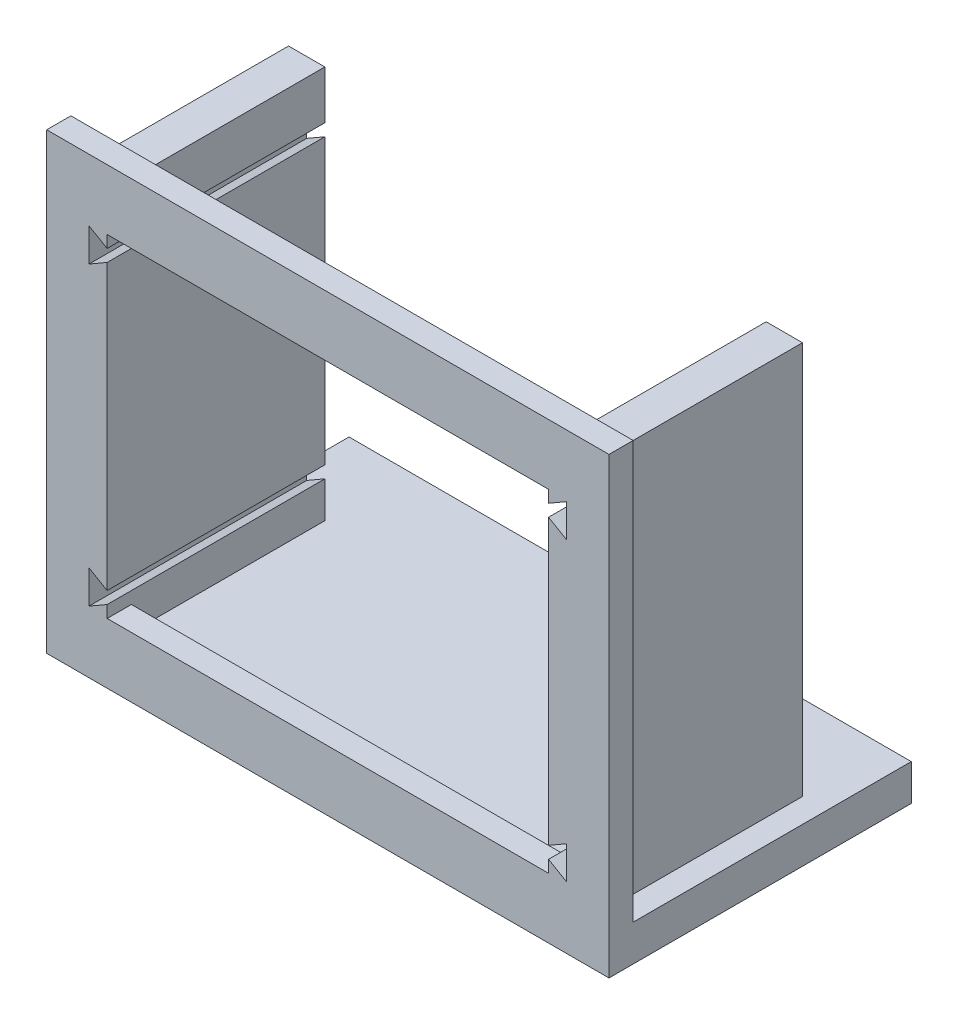
from build123d import *

# Parameters (mm, degrees)
SKETCH2_W                = 200
SKETCH2_H                = 150
BOSS_EXTRUDE1_DEPTH      = 80
FILLET1_R                = 10
SHELL1_T                 = -2
SHELL1_THICKNESS_2_DEPTH = 13
SKETCH5_W                = 36.5
SKETCH5_H                = 27.5
CUT_EXTRUDE1_DEPTH       = 2
BOSS_EXTRUDE2_DEPTH      = 16
SKETCH7_W                = 36.5
SKETCH7_H                = 27.5
CUT_EXTRUDE2_DEPTH       = 2
BOSS_EXTRUDE3_DEPTH      = 16
SKETCH10_W               = 36.5
SKETCH10_H               = 27.5
CUT_EXTRUDE4_DEPTH       = 2
BOSS_EXTRUDE4_DEPTH      = 16
SKETCH13_W               = 38
SKETCH13_H               = 19.1
CUT_EXTRUDE5_DEPTH       = 2
BOSS_EXTRUDE5_DEPTH      = 13.5
SKETCH15_W               = 10.5
SKETCH15_H               = 9.367949192
CUT_EXTRUDE6_DEPTH       = 3
CUT_EXTRUDE8_REACH       = 150.408
SKETCH20_R               = 8
SPLIT1_SURFACE_1_BACK    = 263.488
SPLIT1_SURFACE_1_DEPTH   = 526.976
SPLIT1_SURFACE_2_BACK    = 263.488
SPLIT1_SURFACE_2_DEPTH   = 526.976
SPLIT2_SURFACE_3_BACK    = 263.488
SPLIT2_SURFACE_3_DEPTH   = 526.976
SPLIT2_SURFACE_4_BACK    = 263.488
SPLIT2_SURFACE_4_DEPTH   = 526.976


with BuildPart() as part:
    # Sketch2 → Boss-Extrude1 (new body)
    with BuildSketch(Plane(origin=(0, 0, 0), x_dir=(1, 0, 0), z_dir=(0, 1, 0))):
        Rectangle(SKETCH2_W, SKETCH2_H)
    extrude(amount=BOSS_EXTRUDE1_DEPTH)

    # Fillet1
    fillet1_edges = [part.edges().sort_by_distance(p)[0] for p in [
        (100, 40, 75),
        (-100, 40, 75),
        (-100, 40, -75),
        (100, 40, -75),
    ]]
    fillet(fillet1_edges, radius=FILLET1_R)

    # Shell1
    shell1_openings = [part.faces().sort_by_distance(p)[0] for p in [
        (0, 80, 0),
    ]]
    offset(amount=SHELL1_T, openings=shell1_openings, kind=Kind.INTERSECTION)

    # Shell1 thickness 2 face (on inner face of the shell) → Shell1 thickness 2 (add)
    with BuildSketch(Plane(origin=(0, 2, 0), x_dir=(0, 0, -1), z_dir=(0, -1, 0))):
        with BuildLine():
            ThreePointArc((73, -90), (70.656854249, -95.656854249), (65, -98))
            Line((65, -98), (-65, -98))
            ThreePointArc((-65, -98), (-70.656854249, -95.656854249), (-73, -90))
            Line((-73, -90), (-73, 90))
            ThreePointArc((-73, 90), (-70.656854249, 95.656854249), (-65, 98))
            Line((-65, 98), (65, 98))
            ThreePointArc((65, 98), (70.656854249, 95.656854249), (73, 90))
            Line((73, 90), (73, -90))
        make_face()
    extrude(amount=-SHELL1_THICKNESS_2_DEPTH)

    # Sketch5 → Cut-Extrude1 (cut)
    with BuildSketch(Plane.XY.offset(75)):
        with Locations((0, 30.75)):
            Rectangle(SKETCH5_W, SKETCH5_H)
        Polygon((-18.25, 43.5), (-19.75, 44.366025404), (-19.75, 41.633974596), (-18.25, 42.5), align=None)
        Polygon((-19.75, 19.866025404), (-18.25, 19), (-18.25, 18), (-19.75, 17.133974596), align=None)
        Polygon((19.75, 17.133974596), (19.75, 19.866025404), (18.25, 19), (18.25, 18), align=None)
        Polygon((19.75, 41.633974596), (18.25, 42.5), (18.25, 43.5), (19.75, 44.366025404), align=None)
    extrude(amount=-CUT_EXTRUDE1_DEPTH, mode=Mode.SUBTRACT)

    # Sketch6 → Boss-Extrude2 (add)
    with BuildSketch(Plane(origin=(0, 0, 73), x_dir=(-1, 0, 0), z_dir=(0, 0, -1))):
        Polygon((18.25, 15), (21.25, 15), (21.25, 47.5), (18.25, 47.5), (18.25, 43.5), (19.75, 44.366025404), (19.75, 41.633974596), (18.25, 42.5), (18.25, 19), (19.75, 19.866025404), (19.75, 17.133974596), (18.25, 18), align=None)
        Polygon((-21.25, 47.5), (-21.25, 15), (-18.25, 15), (-18.25, 18), (-19.75, 17.133974596), (-19.75, 19.866025404), (-18.25, 19), (-18.25, 42.5), (-19.75, 41.633974596), (-19.75, 44.366025404), (-18.25, 43.5), (-18.25, 47.5), align=None)
    extrude(amount=BOSS_EXTRUDE2_DEPTH)

    # Sketch7 → Cut-Extrude2 (cut)
    with BuildSketch(Plane(origin=(100, 0, 0), x_dir=(0, 0, -1), z_dir=(1, 0, 0))):
        with Locations((0, 30.75)):
            Rectangle(SKETCH7_W, SKETCH7_H)
        Polygon((-18.25, 43.5), (-19.75, 44.366025404), (-19.75, 41.633974596), (-18.25, 42.5), align=None)
        Polygon((-19.75, 19.866025404), (-18.25, 19), (-18.25, 18), (-19.75, 17.133974596), align=None)
        Polygon((19.75, 17.133974596), (19.75, 19.866025404), (18.25, 19), (18.25, 18), align=None)
        Polygon((19.75, 41.633974596), (18.25, 42.5), (18.25, 43.5), (19.75, 44.366025404), align=None)
    extrude(amount=-CUT_EXTRUDE2_DEPTH, mode=Mode.SUBTRACT)

    # Sketch8 → Boss-Extrude3 (add)
    with BuildSketch(Plane.ZY.offset(-98)):
        Polygon((-21.25, 47.5), (-18.25, 47.5), (-18.25, 43.5), (-19.75, 44.366025404), (-19.75, 41.633974596), (-18.25, 42.5), (-18.25, 19), (-19.75, 19.866025404), (-19.75, 17.133974596), (-18.25, 18), (-18.25, 15), (-21.25, 15), align=None)
        Polygon((19.75, 44.366025404), (18.25, 43.5), (18.25, 47.5), (21.25, 47.5), (21.25, 15), (18.25, 15), (18.25, 18), (19.75, 17.133974596), (19.75, 19.866025404), (18.25, 19), (18.25, 42.5), (19.75, 41.633974596), align=None)
    extrude(amount=BOSS_EXTRUDE3_DEPTH)

    # Sketch10 → Cut-Extrude4 (cut)
    with BuildSketch(Plane.ZY.offset(100)):
        with Locations((0, 30.75)):
            Rectangle(SKETCH10_W, SKETCH10_H)
        Polygon((-18.25, 43.5), (-19.75, 44.366025404), (-19.75, 41.633974596), (-18.25, 42.5), align=None)
        Polygon((-19.75, 19.866025404), (-18.25, 19), (-18.25, 18), (-19.75, 17.133974596), align=None)
        Polygon((19.75, 17.133974596), (19.75, 19.866025404), (18.25, 19), (18.25, 18), align=None)
        Polygon((19.75, 41.633974596), (18.25, 42.5), (18.25, 43.5), (19.75, 44.366025404), align=None)
    extrude(amount=-CUT_EXTRUDE4_DEPTH, mode=Mode.SUBTRACT)

    # Sketch11 → Boss-Extrude4 (add)
    with BuildSketch(Plane(origin=(-98, 0, 0), x_dir=(0, 0, -1), z_dir=(1, 0, 0))):
        Polygon((-18.25, 47.5), (-21.25, 47.5), (-21.25, 15), (-18.25, 15), (-18.25, 18), (-19.75, 17.133974596), (-19.75, 19.866025404), (-18.25, 19), (-18.25, 42.5), (-19.75, 41.633974596), (-19.75, 44.366025404), (-18.25, 43.5), align=None)
        Polygon((19.75, 44.366025404), (18.25, 43.5), (18.25, 47.5), (21.25, 47.5), (21.25, 15), (18.25, 15), (18.25, 18), (19.75, 17.133974596), (19.75, 19.866025404), (18.25, 19), (18.25, 42.5), (19.75, 41.633974596), align=None)
    extrude(amount=BOSS_EXTRUDE4_DEPTH)

    # Sketch13 → Cut-Extrude5 (cut)
    with BuildSketch(Plane.XY.offset(75)):
        Polygon((41, 39.3), (39.5, 40.166025404), (39.5, 37.433974596), (41, 38.3), align=None)
        with Locations((60, 30.75)):
            Rectangle(SKETCH13_W, SKETCH13_H)
        Polygon((41, 22.2), (39.5, 21.333974596), (39.5, 24.066025404), (41, 23.2), align=None)
        Polygon((79, 22.2), (79, 23.2), (80.5, 24.066025404), (80.5, 21.333974596), align=None)
        Polygon((79, 39.3), (80.5, 40.166025404), (80.5, 37.433974596), (79, 38.3), align=None)
    extrude(amount=-CUT_EXTRUDE5_DEPTH, mode=Mode.SUBTRACT)

    # Sketch14 → Boss-Extrude5 (add)
    with BuildSketch(Plane(origin=(0, 0, 73), x_dir=(-1, 0, 0), z_dir=(0, 0, -1))):
        Polygon((-79, 43.3), (-82, 43.3), (-82, 15), (-79, 15), (-79, 22.2), (-80.5, 21.333974596), (-80.5, 24.066025404), (-79, 23.2), (-79, 38.3), (-80.5, 37.433974596), (-80.5, 40.166025404), (-79, 39.3), align=None)
        Polygon((-39.5, 40.166025404), (-41, 39.3), (-41, 43.3), (-38, 43.3), (-38, 15), (-41, 15), (-41, 22.2), (-39.5, 21.333974596), (-39.5, 24.066025404), (-41, 23.2), (-41, 38.3), (-39.5, 37.433974596), align=None)
    extrude(amount=BOSS_EXTRUDE5_DEPTH)

    # Sketch15 → Cut-Extrude6 (cut)
    with BuildSketch(Plane.ZY.offset(-38)):
        with Locations((66.75, 30.75)):
            Rectangle(SKETCH15_W, SKETCH15_H)
    extrude(amount=-CUT_EXTRUDE6_DEPTH, mode=Mode.SUBTRACT)

    # Sketch18 → Cut-Revolve1 (revolve, cut)
    with BuildSketch(Plane(origin=(0, 0, 0), x_dir=(0, 0, -1), z_dir=(1, 0, 0)), mode=Mode.PRIVATE) as cut_revolve1_sk:
        Polygon((-42.5, 0), (-70, 0), (-47.5, 10), (-42.5, 10), align=None)
    revolve(cut_revolve1_sk.sketch.rotate(Axis((0, 0, 0), (0, 1, 0)), 180), axis=Axis((0, 0, 0), (0, 1, 0)), mode=Mode.SUBTRACT)

    # Cut-Extrude8: up to this face of the body (flat: up to its plane)
    cut_extrude8_end = Plane(part.part.faces().sort_by_distance((-0.172388952, 15, -0.411685035))[0])
    # Sketch20 → Cut-Extrude8 (cut, up to the picked face)
    with BuildSketch(Plane.XZ, mode=Mode.PRIVATE) as cut_extrude8_sk1:
        with Locations(Location((0, -42.5, 0), (0, 0, 270))):
            Circle(SKETCH20_R)
    cut_extrude8_tool1 = split(extrude(cut_extrude8_sk1.sketch, amount=-CUT_EXTRUDE8_REACH, mode=Mode.PRIVATE), bisect_by=cut_extrude8_end, keep=Keep.BOTH, mode=Mode.PRIVATE)
    add(cut_extrude8_tool1.solids().sort_by(Axis((0, 0, -42.5), (0, 1, 0)))[0], mode=Mode.SUBTRACT)


with BuildPart() as body_2:
    # Split1: the piece behind the surface
    add(part.part)
    # Split1 surface: a surface, the sketch's curves swept straight by 526.976 mm
    with BuildLine(Plane.XY.offset(75).offset(-SPLIT1_SURFACE_1_BACK), mode=Mode.PRIVATE) as split1_surface_1_path:
        Line((-23.25, 49.5), (23.25, 49.5))
        Line((23.25, 49.5), (23.25, 12))
        Line((23.25, 12), (-23.25, 12))
        Line((-23.25, 12), (-23.25, 49.5))
    split1_surface_1 = Shell.extrude(split1_surface_1_path.wire(), (0 * SPLIT1_SURFACE_1_DEPTH, 0 * SPLIT1_SURFACE_1_DEPTH, 1 * SPLIT1_SURFACE_1_DEPTH))
    split(bisect_by=split1_surface_1, keep=Keep.BOTTOM)


with BuildPart() as part_1:
    add(part.part)

    # Split1: split by a surface, the side it looks to stays
    # Split1 surface: a surface, the sketch's curves swept straight by 526.976 mm
    with BuildLine(Plane.XY.offset(75).offset(-SPLIT1_SURFACE_2_BACK), mode=Mode.PRIVATE) as split1_surface_2_path:
        Line((-23.25, 49.5), (23.25, 49.5))
        Line((23.25, 49.5), (23.25, 12))
        Line((23.25, 12), (-23.25, 12))
        Line((-23.25, 12), (-23.25, 49.5))
    split1_surface_2 = Shell.extrude(split1_surface_2_path.wire(), (0 * SPLIT1_SURFACE_2_DEPTH, 0 * SPLIT1_SURFACE_2_DEPTH, 1 * SPLIT1_SURFACE_2_DEPTH))
    split(bisect_by=split1_surface_2, keep=Keep.TOP)


with BuildPart() as body_3:
    # Split2: the piece behind the surface
    add(body_2.part)
    # Split2 surface: a surface, the sketch's curves swept straight by 526.976 mm
    with BuildLine(Plane(origin=(0, 15, 0), x_dir=(1, 0, 0), z_dir=(0, 1, 0)).offset(-SPLIT2_SURFACE_3_BACK), mode=Mode.PRIVATE) as split2_surface_3_path:
        Line((-23.25, -75), (23.25, -75))
        Line((23.25, -75), (23.25, -50))
        Line((23.25, -50), (-23.25, -50))
        Line((-23.25, -50), (-23.25, -75))
    split2_surface_3 = Shell.extrude(split2_surface_3_path.wire(), (0 * SPLIT2_SURFACE_3_DEPTH, 1 * SPLIT2_SURFACE_3_DEPTH, 0 * SPLIT2_SURFACE_3_DEPTH))
    split(bisect_by=split2_surface_3, keep=Keep.BOTTOM)


with BuildPart() as body_2_1:
    add(body_2.part)

    # Split2: split by a surface, the side it looks to stays
    # Split2 surface: a surface, the sketch's curves swept straight by 526.976 mm
    with BuildLine(Plane(origin=(0, 15, 0), x_dir=(1, 0, 0), z_dir=(0, 1, 0)).offset(-SPLIT2_SURFACE_4_BACK), mode=Mode.PRIVATE) as split2_surface_4_path:
        Line((-23.25, -75), (23.25, -75))
        Line((23.25, -75), (23.25, -50))
        Line((23.25, -50), (-23.25, -50))
        Line((-23.25, -50), (-23.25, -75))
    split2_surface_4 = Shell.extrude(split2_surface_4_path.wire(), (0 * SPLIT2_SURFACE_4_DEPTH, 1 * SPLIT2_SURFACE_4_DEPTH, 0 * SPLIT2_SURFACE_4_DEPTH))
    split(bisect_by=split2_surface_4, keep=Keep.TOP)


solid = body_2_1.part
